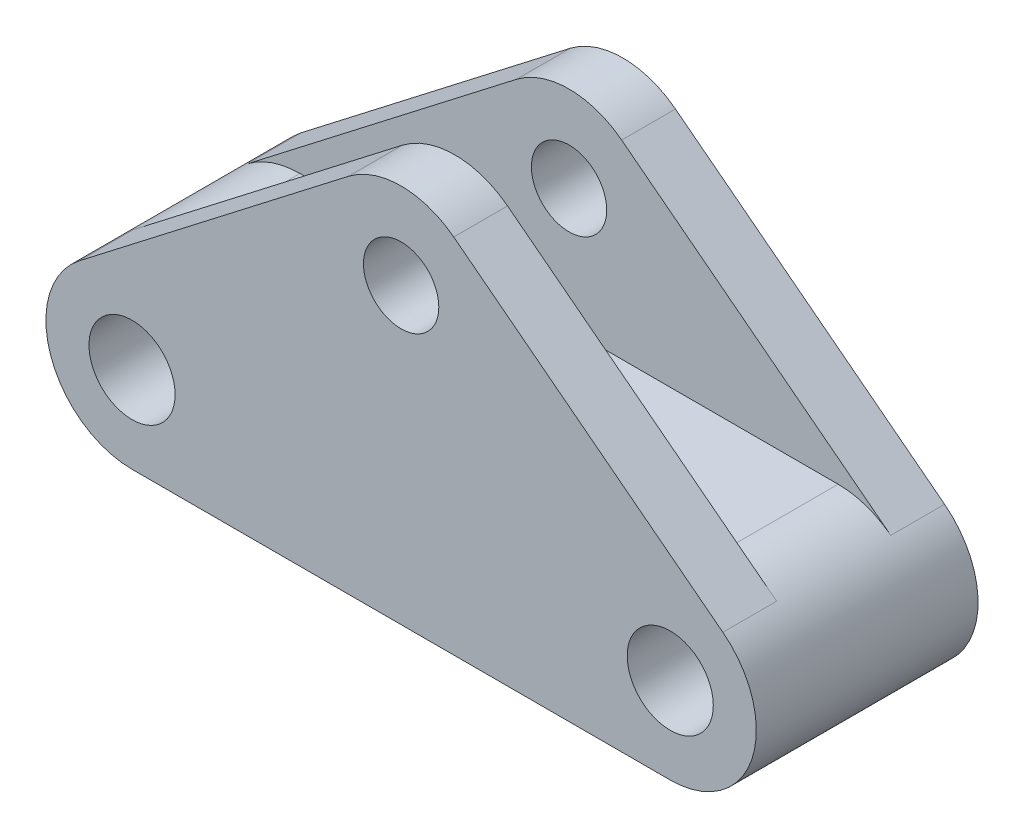
from build123d import *

# Parameters (mm, degrees)
SKETCH1_R           = 4
BOSS_EXTRUDE1_DEPTH = 5
BOSS_EXTRUDE2_START = -15.6
SKETCH1_3_R         = 4
BOSS_EXTRUDE2_DEPTH = 10.6
BOSS_EXTRUDE3_START = -15.6
SKETCH1_4_R         = 4
BOSS_EXTRUDE3_DEPTH = 5


with BuildPart() as part:
    # Sketch1 → Boss-Extrude1 (new body)
    # profile 1 of 6: a face of its own
    with BuildSketch(Plane.XY):
        with BuildLine():
            ThreePointArc((-25, -11.3), (-27.58262842, -11.728340311), (-29.888695875, -12.967492389))
            ThreePointArc((-29.888695875, -12.967492389), (-32.571659689, -21.88262842), (-25, -27.3))
            Line((-25, -27.3), (0, -27.3))
            Line((0, -27.3), (0, -11.3))
            Line((0, -11.3), (-25, -11.3))
        make_face()
        with Locations((-25, -19.3)):
            Circle(SKETCH1_R, mode=Mode.SUBTRACT)
    # profile 2 of 6: a face of its own
    with BuildSketch(Plane.XY):
        with BuildLine():
            ThreePointArc((25, -27.3), (32.571659689, -21.88262842), (29.888695875, -12.967492389))
            ThreePointArc((29.888695875, -12.967492389), (27.58262842, -11.728340311), (25, -11.3))
            Line((25, -11.3), (0, -11.3))
            Line((0, -11.3), (0, -27.3))
            Line((0, -27.3), (25, -27.3))
        make_face()
        with Locations((25, -19.3)):
            Circle(SKETCH1_R, mode=Mode.SUBTRACT)
    # profile 3 of 6: a face of its own
    with BuildSketch(Plane.XY):
        with BuildLine():
            Line((29.888695875, -12.967492389), (10.864868878, 1.718902053))
            ThreePointArc((10.864868878, 1.718902053), (10.966165183, 0.862102762), (11, 0))
            ThreePointArc((11, 0), (7.778174593, -7.778174593), (0, -11))
            Line((0, -11), (0, -11.3))
            Line((0, -11.3), (25, -11.3))
            ThreePointArc((25, -11.3), (27.58262842, -11.728340311), (29.888695875, -12.967492389))
        make_face()
    # profile 4 of 6: a face of its own
    with BuildSketch(Plane.XY):
        with BuildLine():
            ThreePointArc((4.888695875, 6.332507611), (2.58262842, 7.571659689), (0, 8))
            Line((0, 8), (0, 3.5))
            ThreePointArc((0, 3.5), (2.474873734, 2.474873734), (3.5, 0))
            ThreePointArc((3.5, 0), (2.474873734, -2.474873734), (0, -3.5))
            Line((0, -3.5), (0, -11))
            ThreePointArc((0, -11), (7.778174593, -7.778174593), (11, 0))
            ThreePointArc((11, 0), (10.966165183, 0.862102762), (10.864868878, 1.718902053))
            Line((10.864868878, 1.718902053), (4.888695875, 6.332507611))
        make_face()
    # profile 5 of 6: a face of its own
    with BuildSketch(Plane.XY):
        with BuildLine():
            Line((0, 3.5), (0, 8))
            ThreePointArc((0, 8), (-2.58262842, 7.571659689), (-4.888695875, 6.332507611))
            Line((-4.888695875, 6.332507611), (-10.864868878, 1.718902053))
            ThreePointArc((-10.864868878, 1.718902053), (-8.363848474, -7.144651056), (0, -11))
            Line((0, -11), (0, -3.5))
            ThreePointArc((0, -3.5), (-3.5, 0), (0, 3.5))
        make_face()
    # profile 6 of 6: a face of its own
    with BuildSketch(Plane.XY):
        with BuildLine():
            ThreePointArc((0, -11), (-8.363848474, -7.144651056), (-10.864868878, 1.718902053))
            Line((-10.864868878, 1.718902053), (-29.888695875, -12.967492389))
            ThreePointArc((-29.888695875, -12.967492389), (-27.58262842, -11.728340311), (-25, -11.3))
            Line((-25, -11.3), (0, -11.3))
            Line((0, -11.3), (0, -11))
        make_face()
    extrude(amount=-BOSS_EXTRUDE1_DEPTH)

    # Sketch1<3> → Boss-Extrude2 (add)
    with BuildSketch(Plane.XY.offset(BOSS_EXTRUDE2_START)):
        with BuildLine():
            Line((-25, -27.3), (25, -27.3))
            ThreePointArc((25, -27.3), (32.571659689, -21.88262842), (29.888695875, -12.967492389))
            ThreePointArc((29.888695875, -12.967492389), (27.58262842, -11.728340311), (25, -11.3))
            Line((25, -11.3), (-25, -11.3))
            ThreePointArc((-25, -11.3), (-27.58262842, -11.728340311), (-29.888695875, -12.967492389))
            ThreePointArc((-29.888695875, -12.967492389), (-32.571659689, -21.88262842), (-25, -27.3))
        make_face()
        with Locations((-25, -19.3)):
            Circle(SKETCH1_3_R, mode=Mode.SUBTRACT)
        with Locations((25, -19.3)):
            Circle(SKETCH1_3_R, mode=Mode.SUBTRACT)
    extrude(amount=BOSS_EXTRUDE2_DEPTH)

    # Sketch1<4> → Boss-Extrude3 (add)
    # profile 1 of 6: a face of its own
    with BuildSketch(Plane.XY.offset(BOSS_EXTRUDE3_START)):
        with BuildLine():
            ThreePointArc((0, -11), (-8.363848474, -7.144651056), (-10.864868878, 1.718902053))
            Line((-10.864868878, 1.718902053), (-29.888695875, -12.967492389))
            ThreePointArc((-29.888695875, -12.967492389), (-27.58262842, -11.728340311), (-25, -11.3))
            Line((-25, -11.3), (0, -11.3))
            Line((0, -11.3), (0, -11))
        make_face()
    # profile 2 of 6: a face of its own
    with BuildSketch(Plane.XY.offset(BOSS_EXTRUDE3_START)):
        with BuildLine():
            Line((0, 3.5), (0, 8))
            ThreePointArc((0, 8), (-2.58262842, 7.571659689), (-4.888695875, 6.332507611))
            Line((-4.888695875, 6.332507611), (-10.864868878, 1.718902053))
            ThreePointArc((-10.864868878, 1.718902053), (-8.363848474, -7.144651056), (0, -11))
            Line((0, -11), (0, -3.5))
            ThreePointArc((0, -3.5), (-3.5, 0), (0, 3.5))
        make_face()
    # profile 3 of 6: a face of its own
    with BuildSketch(Plane.XY.offset(BOSS_EXTRUDE3_START)):
        with BuildLine():
            ThreePointArc((4.888695875, 6.332507611), (2.58262842, 7.571659689), (0, 8))
            Line((0, 8), (0, 3.5))
            ThreePointArc((0, 3.5), (2.474873734, 2.474873734), (3.5, 0))
            ThreePointArc((3.5, 0), (2.474873734, -2.474873734), (0, -3.5))
            Line((0, -3.5), (0, -11))
            ThreePointArc((0, -11), (7.778174593, -7.778174593), (11, 0))
            ThreePointArc((11, 0), (10.966165183, 0.862102762), (10.864868878, 1.718902053))
            Line((10.864868878, 1.718902053), (4.888695875, 6.332507611))
        make_face()
    # profile 4 of 6: a face of its own
    with BuildSketch(Plane.XY.offset(BOSS_EXTRUDE3_START)):
        with BuildLine():
            Line((29.888695875, -12.967492389), (10.864868878, 1.718902053))
            ThreePointArc((10.864868878, 1.718902053), (10.966165183, 0.862102762), (11, 0))
            ThreePointArc((11, 0), (7.778174593, -7.778174593), (0, -11))
            Line((0, -11), (0, -11.3))
            Line((0, -11.3), (25, -11.3))
            ThreePointArc((25, -11.3), (27.58262842, -11.728340311), (29.888695875, -12.967492389))
        make_face()
    # profile 5 of 6: a face of its own
    with BuildSketch(Plane.XY.offset(BOSS_EXTRUDE3_START)):
        with BuildLine():
            ThreePointArc((25, -27.3), (32.571659689, -21.88262842), (29.888695875, -12.967492389))
            ThreePointArc((29.888695875, -12.967492389), (27.58262842, -11.728340311), (25, -11.3))
            Line((25, -11.3), (0, -11.3))
            Line((0, -11.3), (0, -27.3))
            Line((0, -27.3), (25, -27.3))
        make_face()
        with Locations((25, -19.3)):
            Circle(SKETCH1_4_R, mode=Mode.SUBTRACT)
    # profile 6 of 6: a face of its own
    with BuildSketch(Plane.XY.offset(BOSS_EXTRUDE3_START)):
        with BuildLine():
            ThreePointArc((-25, -11.3), (-27.58262842, -11.728340311), (-29.888695875, -12.967492389))
            ThreePointArc((-29.888695875, -12.967492389), (-32.571659689, -21.88262842), (-25, -27.3))
            Line((-25, -27.3), (0, -27.3))
            Line((0, -27.3), (0, -11.3))
            Line((0, -11.3), (-25, -11.3))
        make_face()
        with Locations((-25, -19.3)):
            Circle(SKETCH1_4_R, mode=Mode.SUBTRACT)
    extrude(amount=-BOSS_EXTRUDE3_DEPTH)


solid = part.part
